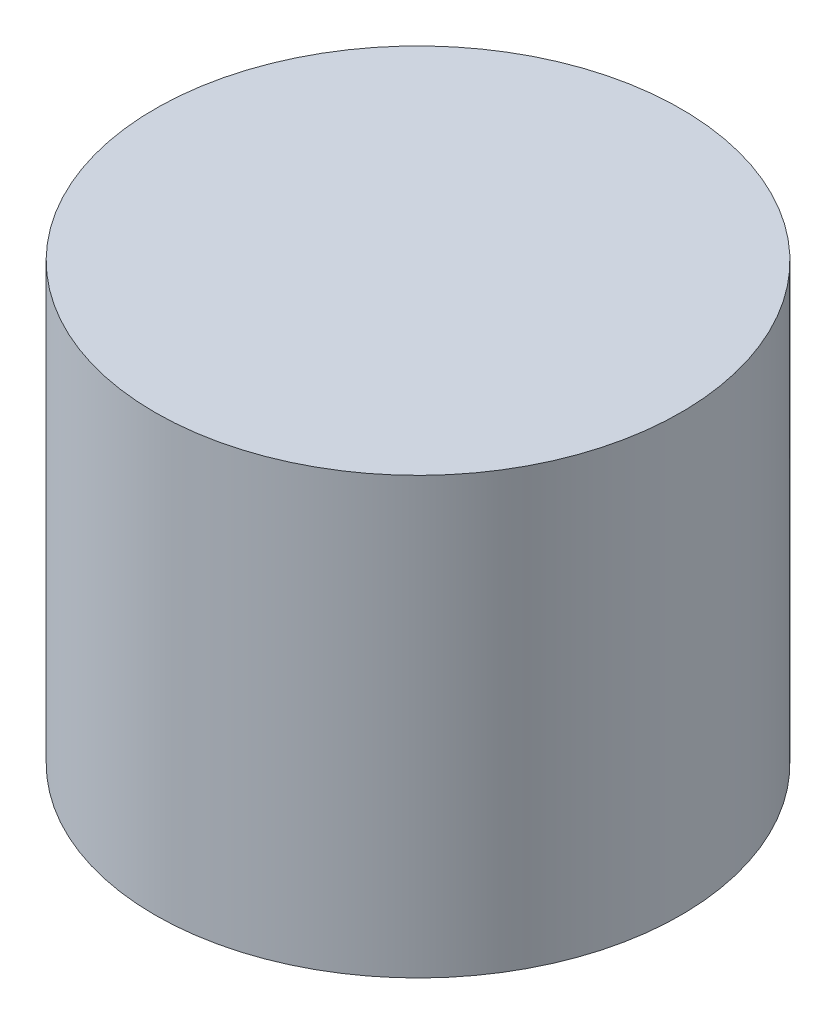
from build123d import *

# Parameters (mm, degrees)
SKETCH_1_R      = 145
EXTRUDE_1_DEPTH = 240


with BuildPart() as part:
    # 草图1 → 凸台-拉伸1 (new body)
    with BuildSketch(Plane(origin=(0, 0, 0), x_dir=(1, 0, 0), z_dir=(0, 1, 0))):
        with Locations(Location((0, 0, 0), (0, 0, 270))):
            Circle(SKETCH_1_R)
    extrude(amount=EXTRUDE_1_DEPTH)


solid = part.part
